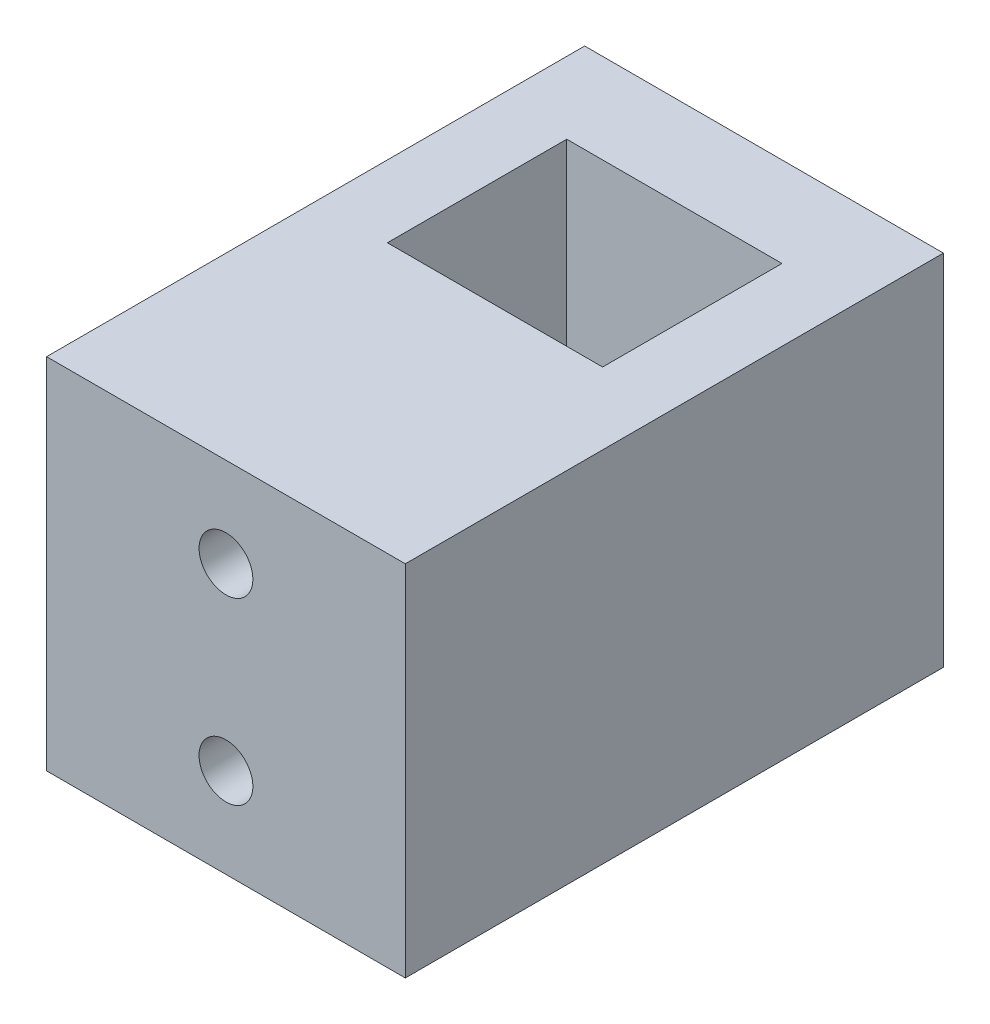
from build123d import *

# Parameters (mm, degrees)
SKETCH1_W           = 20
SKETCH1_H           = 30
BOSS_EXTRUDE1_DEPTH = 20
SKETCH4_W           = 12
SKETCH4_H           = 10
CUT_EXTRUDE2_DEPTH  = 18
SKETCH3_R           = 1.5
CUT_EXTRUDE3_DEPTH  = 38.416573868
SKETCH5_R           = 1.5
CUT_EXTRUDE4_DEPTH  = 10


with BuildPart() as part:
    # Sketch1 → Boss-Extrude1 (new body)
    with BuildSketch(Plane(origin=(0, 0, 0), x_dir=(1, 0, 0), z_dir=(0, 1, 0))):
        with Locations((0, 15)):
            Rectangle(SKETCH1_W, SKETCH1_H)
    extrude(amount=BOSS_EXTRUDE1_DEPTH)

    # Sketch4 → Cut-Extrude2 (cut)
    with BuildSketch(Plane(origin=(0, 20, 0), x_dir=(1, 0, 0), z_dir=(0, 1, 0))):
        with Locations((0, 20)):
            Rectangle(SKETCH4_W, SKETCH4_H)
    extrude(amount=-CUT_EXTRUDE2_DEPTH, mode=Mode.SUBTRACT)

    # Sketch3 → Cut-Extrude3 (cut, through all)
    with BuildSketch(Plane(origin=(0, 0, 0), x_dir=(1, 0, 0), z_dir=(0, 1, 0))):
        with Locations(Location((0, 20, 0), (0, 0, 270))):
            Circle(SKETCH3_R)
    extrude(amount=CUT_EXTRUDE3_DEPTH, mode=Mode.SUBTRACT)

    # Sketch5 → Cut-Extrude4 (cut)
    with BuildSketch(Plane.XY):
        with Locations((0, 15)):
            Circle(SKETCH5_R)
        with Locations(Location((0, 5, 0), (0, 0, 180))):
            Circle(SKETCH5_R)
    extrude(amount=-CUT_EXTRUDE4_DEPTH, mode=Mode.SUBTRACT)


solid = part.part
